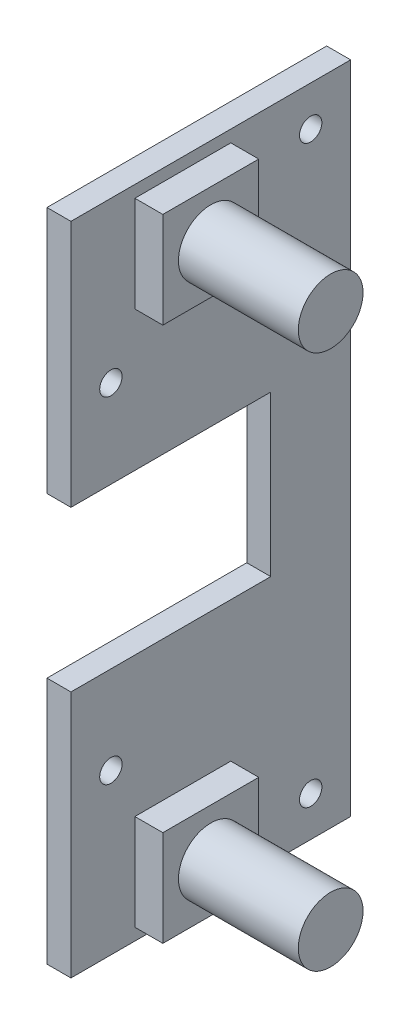
from build123d import *

# Parameters (mm, degrees)
EXTRUDE_1_DEPTH     = 3
SKETCH_2_W          = 12
SKETCH_2_H          = 12
EXTRUDE_2_DEPTH     = 3.5
SKETCH_3_R          = 4.05
EXTRUDE_3_DEPTH     = 15
CUT_EXTRUDE_1_REACH = 58.993
SKETCH_4_R          = 1.4


with BuildPart() as part:
    # 草圖1 → 填料-伸長1 (new body)
    with BuildSketch(Plane(origin=(0, 0, 0), x_dir=(0, 0, -1), z_dir=(1, 0, 0))):
        Polygon((-35, -10), (-35, -41), (0, -41), (0, 41), (-35, 41), (-35, 10), (-10, 10), (-10, -10), align=None)
    extrude(amount=EXTRUDE_1_DEPTH)

    # 草圖2 → 填料-伸長2 (add)
    with BuildSketch(Plane(origin=(3, 0, 0), x_dir=(0, 0, -1), z_dir=(1, 0, 0))):
        with Locations((-21, -33.5)):
            Rectangle(SKETCH_2_W, SKETCH_2_H)
    extrude_2 = extrude(amount=EXTRUDE_2_DEPTH)

    # 草圖3 → 填料-伸長3 (add)
    with BuildSketch(Plane(origin=(6.5, 0, 0), x_dir=(0, 0, -1), z_dir=(1, 0, 0))):
        with Locations((-21, -33.5)):
            Circle(SKETCH_3_R)
    extrude_3 = extrude(amount=EXTRUDE_3_DEPTH)

    # 鏡射1: 填料-伸長2, 填料-伸長3 across plane
    add(extrude_2.mirror(Plane.ZX))
    add(extrude_3.mirror(Plane.ZX))

    # 草圖4 → 除料-伸長1 (cut, up to next)
    with BuildSketch(Plane(origin=(3, 0, 0), x_dir=(0, 0, -1), z_dir=(1, 0, 0)), mode=Mode.PRIVATE) as cut_extrude_1_sk1:
        with Locations((-30, -21)):
            Circle(SKETCH_4_R)
    cut_extrude_1_tool1 = extrude(cut_extrude_1_sk1.sketch, amount=-CUT_EXTRUDE_1_REACH, mode=Mode.PRIVATE) & part.part
    # 草圖4 → 除料-伸長1 (cut, up to next)
    with BuildSketch(Plane(origin=(3, 0, 0), x_dir=(0, 0, -1), z_dir=(1, 0, 0)), mode=Mode.PRIVATE) as cut_extrude_1_sk2:
        with Locations((-5, -36)):
            Circle(SKETCH_4_R)
    cut_extrude_1_tool2 = extrude(cut_extrude_1_sk2.sketch, amount=-CUT_EXTRUDE_1_REACH, mode=Mode.PRIVATE) & part.part
    cut_extrude_1_1 = cut_extrude_1_tool1.solids().sort_by_distance((3, -21, 30))[0]
    add(cut_extrude_1_1, mode=Mode.SUBTRACT)
    cut_extrude_1_2 = cut_extrude_1_tool2.solids().sort_by_distance((3, -36, 5))[0]
    add(cut_extrude_1_2, mode=Mode.SUBTRACT)
    cut_extrude_1 = cut_extrude_1_1 + cut_extrude_1_2  # 除料-伸長1 as one shape, for the pattern or mirror that repeats it

    # 鏡射2: 除料-伸長1 across plane
    add(cut_extrude_1.mirror(Plane.ZX), mode=Mode.SUBTRACT)


solid = part.part
